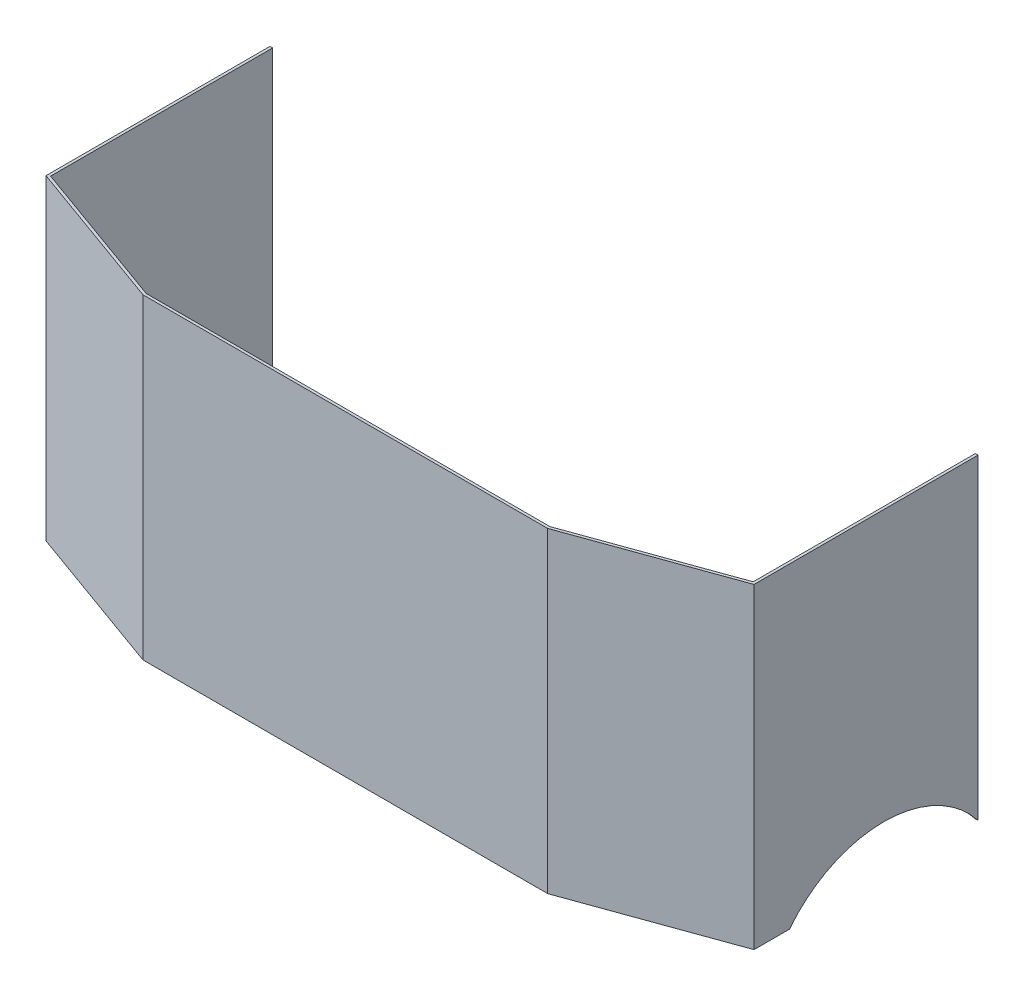
from build123d import *

# Parameters (mm, degrees)
BOSS_EXTRUDE2_DEPTH = 234.9999999
CUT_EXTRUDE1_REACH  = 600.452
SKETCH3_R           = 88.9


with BuildPart() as part:
    # Sketch2 → Boss-Extrude2 (new body)
    with BuildSketch(Plane(origin=(0, 0, 0), x_dir=(1, 0, 0), z_dir=(0, 1, 0))):
        Polygon((-263.000000064, 45.001214275), (-263.000000064, -121.405176327), (-150.349364373, -162), (150.349364373, -162), (263.000000064, -121.405176327), (263.000000064, 45.003453118), (261, 45.003453118), (261, -120), (150, -160), (-150, -160), (-261, -120), (-261, 45.001214275), align=None)
    extrude(amount=BOSS_EXTRUDE2_DEPTH)

    # Cut-Extrude1: up to this face of the body (flat: up to its plane)
    cut_extrude1_end = Plane(part.part.faces().sort_by_distance((263.000000064, 117.49999995, 38.200861605))[0])
    # Sketch3 → Cut-Extrude1 (cut, up to the picked face)
    with BuildSketch(Plane.ZY.offset(263.000000064), mode=Mode.PRIVATE) as cut_extrude1_sk1:
        with Locations((24.999999937, -54.80000008)):
            Circle(SKETCH3_R)
    cut_extrude1_tool1 = split(extrude(cut_extrude1_sk1.sketch, amount=-CUT_EXTRUDE1_REACH, mode=Mode.PRIVATE), bisect_by=cut_extrude1_end, keep=Keep.BOTH, mode=Mode.PRIVATE)
    add(cut_extrude1_tool1.solids().sort_by(Axis((-263, -54.8, 25), (1, 0, 0)))[0], mode=Mode.SUBTRACT)


solid = part.part
